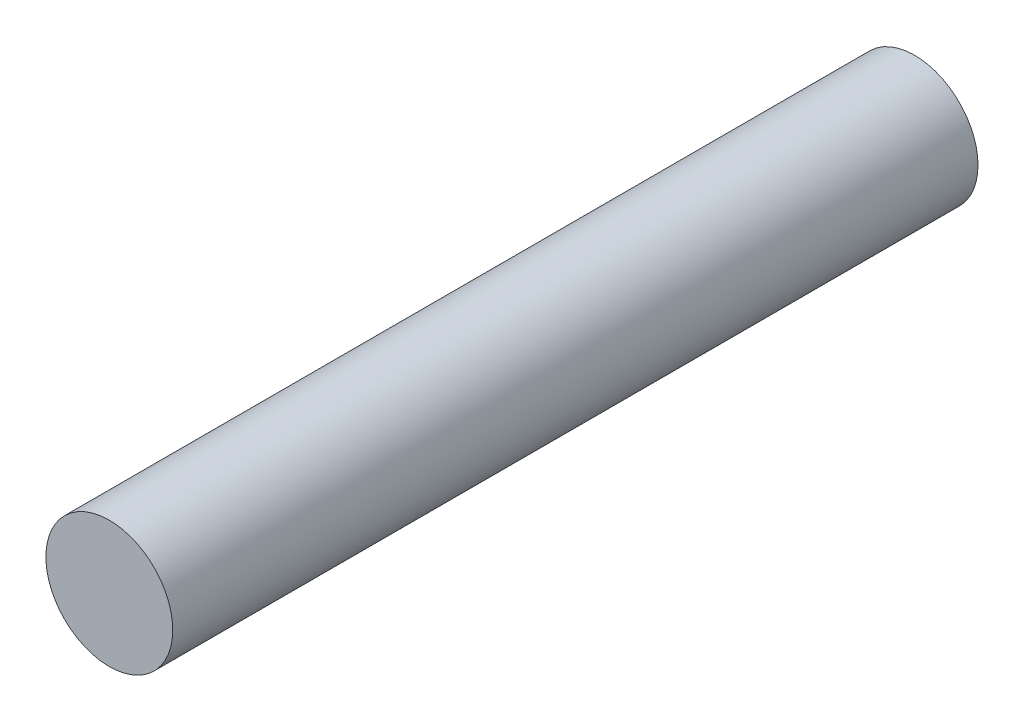
from build123d import *

# Parameters (mm, degrees)
SKETCH1_R           = 20
BOSS_EXTRUDE1_DEPTH = 254


with BuildPart() as part:
    # Sketch1 → Boss-Extrude1 (new body)
    with BuildSketch(Plane.XY):
        Circle(SKETCH1_R)
    extrude(amount=BOSS_EXTRUDE1_DEPTH)


solid = part.part
